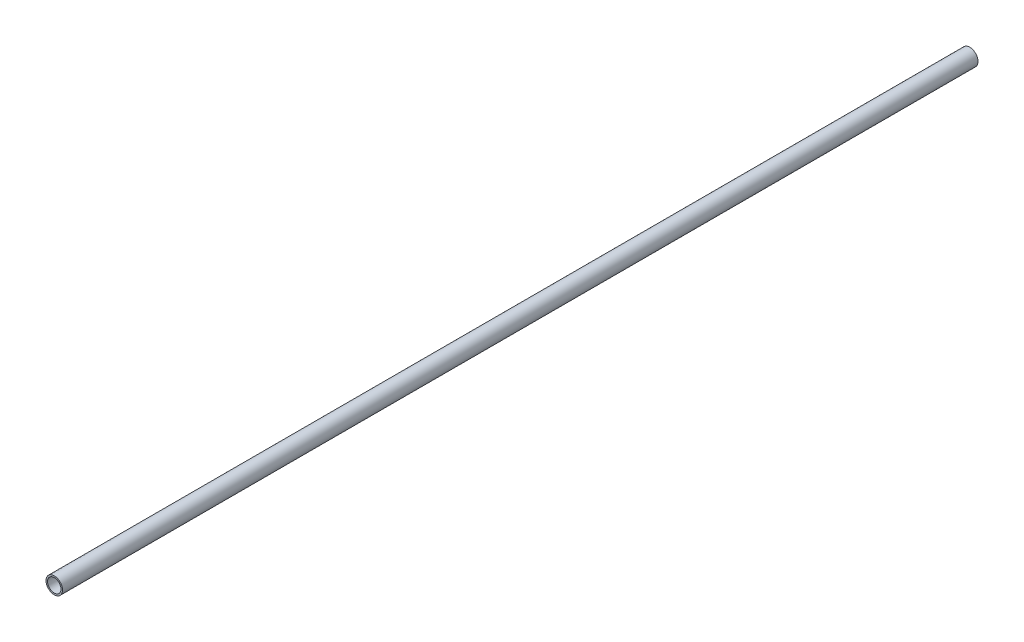
from build123d import *

# Parameters (mm, degrees)
SKIZZE1_R               = 21.35
SKIZZE1_R_2             = 17.35
LINEAR_AUSTRAGEN1_DEPTH = 1185


with BuildPart() as part:
    # Skizze1 → Linear austragen1 (new, symmetric)
    with BuildSketch(Plane.XY):
        with Locations(Location((0, 0, 0), (0, 0, 180))):
            Circle(SKIZZE1_R)
        with Locations(Location((0, 0, 0), (0, 0, 180))):
            Circle(SKIZZE1_R_2, mode=Mode.SUBTRACT)
    extrude(amount=LINEAR_AUSTRAGEN1_DEPTH, both=True)


solid = part.part
